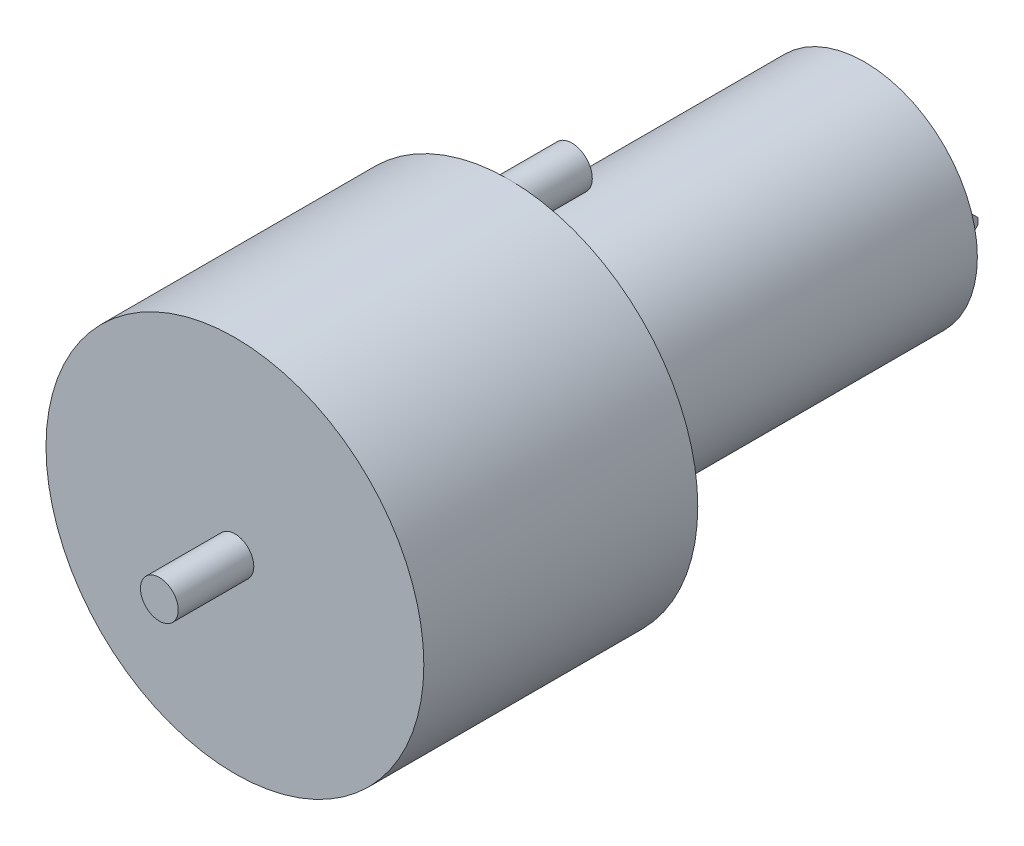
from build123d import *

# Parameters (mm, degrees)
SKETCH_5_R      = 3.25
EXTRUDE_1_DEPTH = 10
EXTRUDE_START   = 12
SKETCH_7_R      = 0.677279549
EXTRUDE_2_DEPTH = 1


with BuildPart() as part:
    # 草图4 → 旋转1 (revolve)
    with BuildSketch(Plane(origin=(0, 0, 0), x_dir=(0, 0, -1), z_dir=(1, 0, 0)), mode=Mode.PRIVATE) as revolve_1_sk:
        Polygon((0, 0), (112, 0), (112, 17.9), (55.5, 17.9), (55.5, 30), (12, 30), (12, 3), (0, 3), align=None)
    revolve(revolve_1_sk.sketch.rotate(Axis((0, 0, 0), (0, 0, -1)), 90), axis=Axis((0, 0, 0), (0, 0, -1)))

    # 草图5 → 凸台-拉伸1 (add)
    with BuildSketch(Plane(origin=(0, 0, -55.5), x_dir=(-1, 0, 0), z_dir=(0, 0, -1))):
        with Locations(Location((0, 26.75, 0), (0, 0, 90))):
            Circle(SKETCH_5_R)
    extrude(amount=EXTRUDE_1_DEPTH)

    # 草图7 → 凸台-拉伸2 (add)
    with BuildSketch(Plane(origin=(0, 0, 0), x_dir=(0, 0, -1), z_dir=(1, 0, 0)).offset(EXTRUDE_START)):
        Polygon((112, 0), (112, 1.5), (116, 1.5), (117, 0.5), (117, -0.5), (116, -1.5), (112, -1.5), align=None)
        with Locations((115.558241223, 0)):
            Circle(SKETCH_7_R, mode=Mode.SUBTRACT)
    extrude_2 = extrude(amount=EXTRUDE_2_DEPTH)

    # 镜向1: 凸台-拉伸2 across plane
    add(extrude_2.mirror(Plane(origin=(0, 0, 0), x_dir=(0, 0, 1), z_dir=(1, 0, 0))))


solid = part.part
